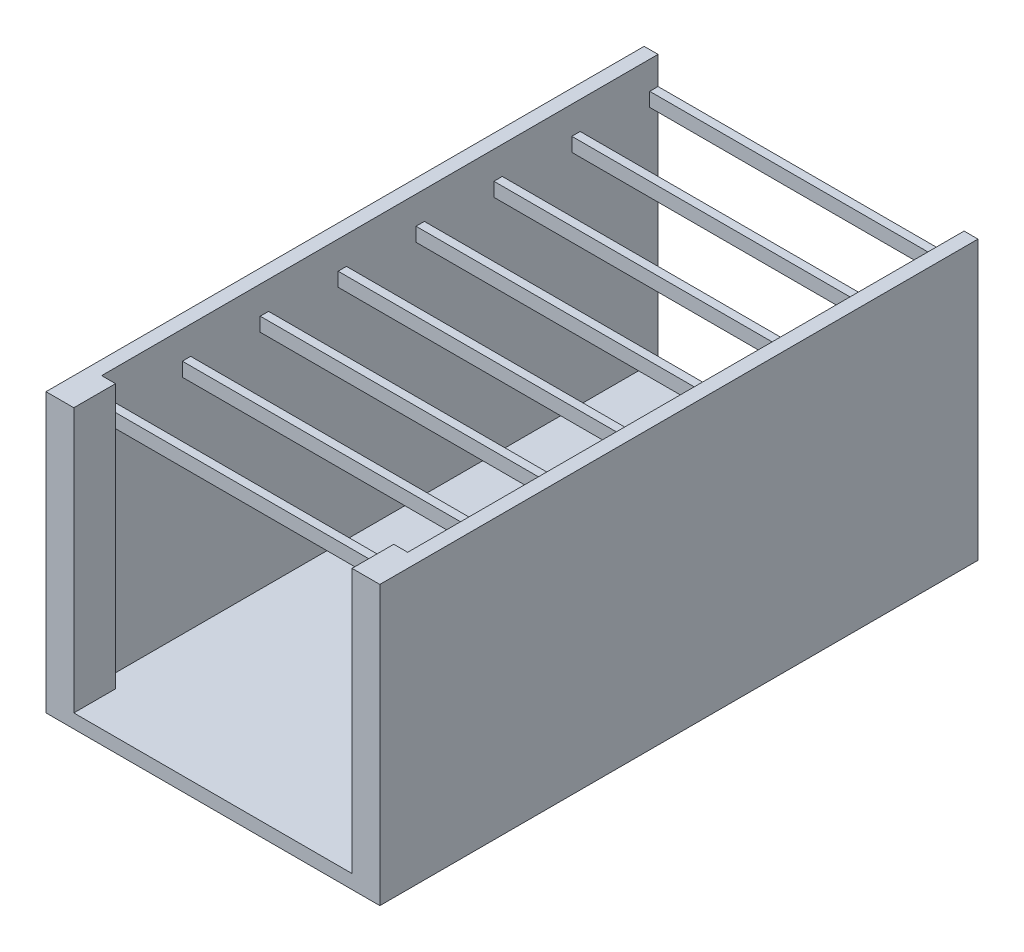
from build123d import *

# Parameters (mm, degrees)
BOSS_EXTRUDE1_DEPTH = 200
SKETCH2_W           = 110
SKETCH2_H           = 25
CUT_EXTRUDE1_DEPTH  = 50
BOSS_EXTRUDE2_DEPTH = 15


with BuildPart() as part:
    # Sketch1 → Boss-Extrude1 (new body)
    with BuildSketch(Plane.XY):
        Polygon((0, 5), (0, 0), (120, 0), (120, 5.000009832), (120, 85.000009832), (120, 90), (120, 100), (115, 100), (115, 90), (5, 90), (5, 100), (0, 100), (0, 90), (0, 85), align=None)
        Polygon((115, 45.000009832), (115, 5.000009832), (5, 5.000009832), (5, 45.000009832), (5, 50.000009832), (5, 85.000009832), (115, 85.000009832), (115, 50.000009832), align=None, mode=Mode.SUBTRACT)
    extrude(amount=-BOSS_EXTRUDE1_DEPTH)

    # Sketch2 → Cut-Extrude1 (cut)
    with BuildSketch(Plane(origin=(0, 90, 0), x_dir=(1, 0, 0), z_dir=(0, 1, 0))):
        with Locations((60, 184.5)):
            Rectangle(SKETCH2_W, SKETCH2_H)
        with Locations((60, 156.5)):
            Rectangle(SKETCH2_W, SKETCH2_H)
        with Locations((60, 128.5)):
            Rectangle(SKETCH2_W, SKETCH2_H)
        with Locations((60, 100.5)):
            Rectangle(SKETCH2_W, SKETCH2_H)
        with Locations((60, 72.5)):
            Rectangle(SKETCH2_W, SKETCH2_H)
        with Locations((60, 44.5)):
            Rectangle(SKETCH2_W, SKETCH2_H)
        with Locations((60, 16.5)):
            Rectangle(SKETCH2_W, SKETCH2_H)
        with Locations((60, -11.5)):
            Rectangle(SKETCH2_W, SKETCH2_H)
    extrude(amount=-CUT_EXTRUDE1_DEPTH, mode=Mode.SUBTRACT)

    # Sketch3 → Boss-Extrude2 (add)
    with BuildSketch(Plane.XY):
        Polygon((0, 100), (10, 100), (10, 5.000009832), (110, 5.000009832), (110, 100), (120, 100), (120, 0), (0, 0), align=None)
    extrude(amount=BOSS_EXTRUDE2_DEPTH)


solid = part.part
